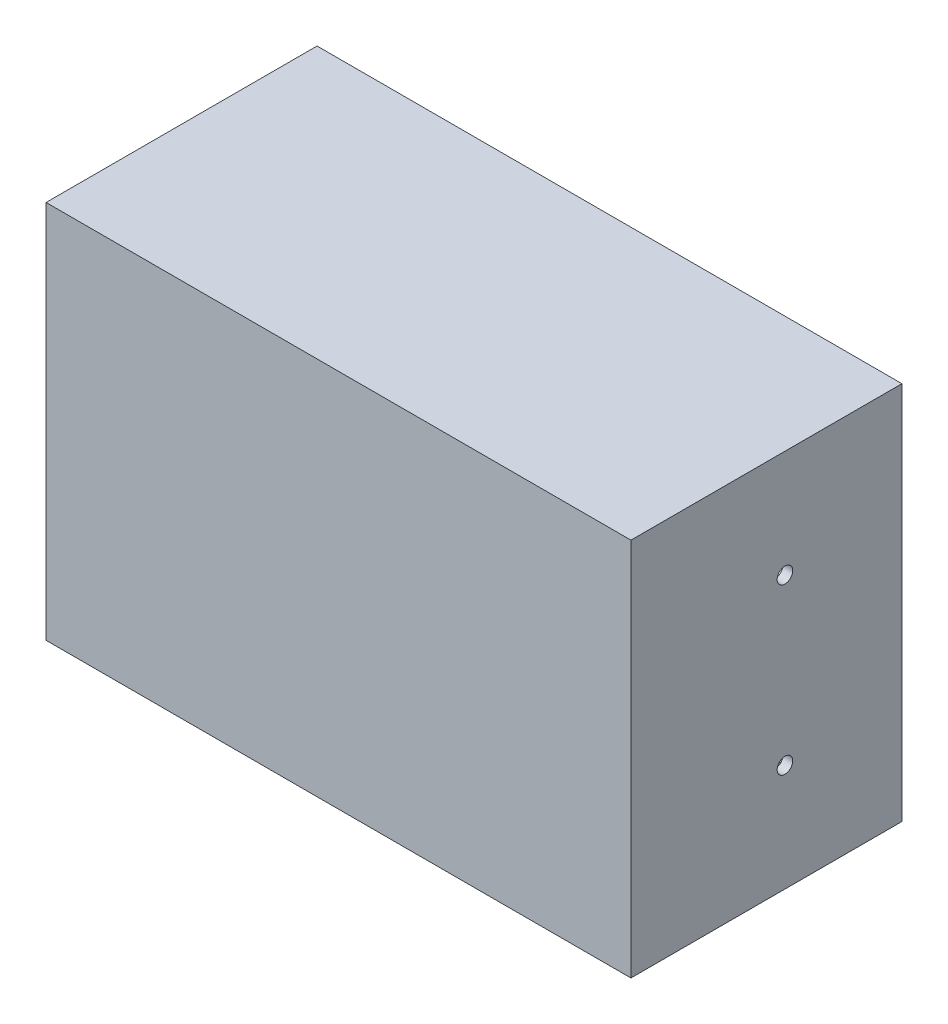
from build123d import *

# Parameters (mm, degrees)
SKIZZE1_W                       = 300
SKIZZE1_H                       = 194.5
AUFSATZ_LINEAR_AUSTRAGEN1_DEPTH = 139
SKIZZE2_W                       = 290
SKIZZE2_H                       = 184.5
SCHNITT_LINEAR_AUSTRAGEN1_DEPTH = 134
F_8_0MM_STIFTLOCH1_D            = 8
SKIZZE8_W                       = 290
SKIZZE8_H                       = 184.5
SKIZZE8_W_2                     = 250
SKIZZE8_H_2                     = 144.5
AUFSATZ_LINEAR_AUSTRAGEN2_DEPTH = 25
AUFSATZ_LINEAR_AUSTRAGEN3_REACH = 211.377
SKIZZE9_W                       = 20
SKIZZE9_H                       = 20
SPIEGELN5_COPY_1_REACH          = 211.377
SPIEGELN5_COPY_1_SKETCH_W       = 20
SPIEGELN5_COPY_1_SKETCH_H       = 20
SKIZZE16_W                      = 290
SKIZZE16_H                      = 184.5
SKIZZE16_W_2                    = 250
SKIZZE16_H_2                    = 144.5
AUFSATZ_LINEAR_AUSTRAGEN4_DEPTH = 20


with BuildPart() as part:
    # Skizze1 → Aufsatz-Linear austragen1 (new body)
    with BuildSketch(Plane.XY):
        Rectangle(SKIZZE1_W, SKIZZE1_H)
    extrude(amount=AUFSATZ_LINEAR_AUSTRAGEN1_DEPTH)

    # Skizze2 → Schnitt-Linear austragen1 (cut)
    with BuildSketch(Plane(origin=(0, 0, 0), x_dir=(-1, 0, 0), z_dir=(0, 0, -1))):
        Rectangle(SKIZZE2_W, SKIZZE2_H)
    extrude(amount=-SCHNITT_LINEAR_AUSTRAGEN1_DEPTH, mode=Mode.SUBTRACT)

    # Ø8.0mm Stiftloch1 (through all)
    with Locations(Plane.ZY.offset(150)):
        with Locations((60, -42.25)):
            f_8_0mm_stiftloch1 = Hole(F_8_0MM_STIFTLOCH1_D / 2)

    # Spiegeln1: Ø8.0mm Stiftloch1 across plane
    add(f_8_0mm_stiftloch1.mirror(Plane.ZX), mode=Mode.SUBTRACT)

    # Skizze8 → Aufsatz-Linear austragen2 (add)
    with BuildSketch(Plane(origin=(0, 0, 30), x_dir=(-1, 0, 0), z_dir=(0, 0, -1))):
        Rectangle(SKIZZE8_W, SKIZZE8_H)
        Rectangle(SKIZZE8_W_2, SKIZZE8_H_2, mode=Mode.SUBTRACT)
    extrude(amount=AUFSATZ_LINEAR_AUSTRAGEN2_DEPTH)

    # Skizze9 → Aufsatz-Linear austragen3 (add, up to next)
    with BuildSketch(Plane(origin=(0, 0, 30), x_dir=(-1, 0, 0), z_dir=(0, 0, -1)), mode=Mode.PRIVATE) as aufsatz_linear_austragen3_sk1:
        with Locations((-135, -82.25)):
            Rectangle(SKIZZE9_W, SKIZZE9_H)
    aufsatz_linear_austragen3_tool1 = extrude(aufsatz_linear_austragen3_sk1.sketch, amount=-AUFSATZ_LINEAR_AUSTRAGEN3_REACH, mode=Mode.PRIVATE) - part.part
    aufsatz_linear_austragen3 = aufsatz_linear_austragen3_tool1.solids().sort_by_distance((135, -82.25, 30))[0]
    add(aufsatz_linear_austragen3)

    # Skizze15 → Kernloch für M4x0.71 (revolve, cut)
    with BuildSketch(Plane(origin=(135, -82.25, 5), x_dir=(0, 1, 0), z_dir=(1, 0, 0))):
        Polygon((0, 0), (0, 20.991420021), (1.65, 20), (1.65, 0), align=None)
    kernloch_f_r_m4x0_71 = revolve(axis=Axis((135, -82.25, -1.35), (0, 0, 1)), mode=Mode.SUBTRACT)

    # Spiegeln4: Aufsatz-Linear austragen3, Kernloch für M4x0.71 across plane
    add(aufsatz_linear_austragen3.mirror(Plane.ZX))
    add(kernloch_f_r_m4x0_71.mirror(Plane.ZX), mode=Mode.SUBTRACT)

    # Spiegeln5: Aufsatz-Linear austragen3, Kernloch für M4x0.71 across plane
    add(aufsatz_linear_austragen3.mirror(Plane(origin=(0, 0, 0), x_dir=(0, 0, 1), z_dir=(1, 0, 0))))
    add(kernloch_f_r_m4x0_71.mirror(Plane(origin=(0, 0, 0), x_dir=(0, 0, 1), z_dir=(1, 0, 0))), mode=Mode.SUBTRACT)

    # Spiegeln5 copy 1 sketch → Spiegeln5 copy 1 (add, up to next)
    with BuildSketch(Plane(origin=(0, 0, 30), x_dir=(1, 0, 0), z_dir=(0, 0, -1)), mode=Mode.PRIVATE) as spiegeln5_copy_1_sk1:
        with Locations((-135, -82.25)):
            Rectangle(SPIEGELN5_COPY_1_SKETCH_W, SPIEGELN5_COPY_1_SKETCH_H)
    spiegeln5_copy_1_tool1 = extrude(spiegeln5_copy_1_sk1.sketch, amount=-SPIEGELN5_COPY_1_REACH, mode=Mode.PRIVATE) - part.part
    add(spiegeln5_copy_1_tool1.solids().sort_by_distance((-135, 82.25, 30))[0])

    # Spiegeln5 copy 2 sketch → Spiegeln5 copy 2 (revolve, cut)
    with BuildSketch(Plane(origin=(-135, 82.25, 5), x_dir=(0, -1, 0), z_dir=(-1, 0, 0))):
        Polygon((0, 0), (0, 20.991420021), (1.65, 20), (1.65, 0), align=None)
    revolve(axis=Axis((-135, 82.25, -1.35), (0, 0, 1)), mode=Mode.SUBTRACT)

    # Skizze16 → Aufsatz-Linear austragen4 (add)
    with BuildSketch(Plane(origin=(0, 0, 134), x_dir=(-1, 0, 0), z_dir=(0, 0, -1))):
        Rectangle(SKIZZE16_W, SKIZZE16_H)
        Rectangle(SKIZZE16_W_2, SKIZZE16_H_2, mode=Mode.SUBTRACT)
    extrude(amount=AUFSATZ_LINEAR_AUSTRAGEN4_DEPTH)


solid = part.part
